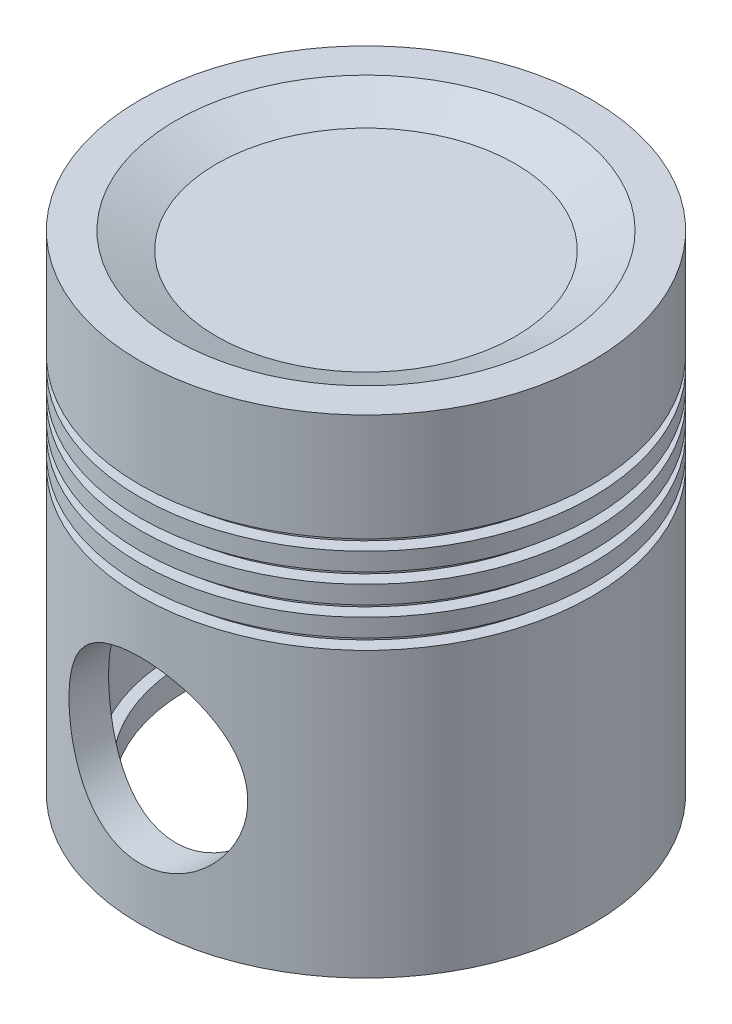
from build123d import *

# Parameters (mm, degrees)
CUT_EXTRUDE2_DEPTH      = 115.535519609
CUT_EXTRUDE2_DEPTH_BACK = 115.535519609
SKETCH2_R               = 25
SKETCH3_R               = 50
CUT_EXTRUDE4_DEPTH      = 11


with BuildPart() as part:
    # Sketch1 → Revolve1 (revolve)
    with BuildSketch(Plane.XY, mode=Mode.PRIVATE) as revolve1_sk:
        Polygon((-63.203744258, 71.61674857), (-63.203744258, 41.61674857), (-59.626173828, 41.61674857), (-59.626173828, 38.61674857), (-63.203744258, 38.61674857), (-63.203744258, 33.61674857), (-59.626173828, 33.61674857), (-59.626173828, 30.61674857), (-63.203744258, 30.61674857), (-63.203744258, 25.61674857), (-59.626173828, 25.61674857), (-59.626173828, 22.61674857), (-63.203744258, 22.61674857), (-63.203744258, 17.61674857), (-59.626173828, 17.61674857), (-59.626173828, 14.61674857), (-63.203744258, 14.61674857), (-63.203744258, -64.740949558), (0, -64.740949558), (0, -57.740949558), (-53.203744258, -57.740949558), (-53.203744258, 56.61674857), (0, 56.61674857), (0, 66.852401658), (-41.78964032, 66.852401658), (-53.203744258, 71.61674857), align=None)
    revolve(revolve1_sk.sketch.rotate(Axis((0, 112.693468535, 0), (0, -1, 0)), 270), axis=Axis((0, 112.693468535, 0), (0, -1, 0)))

    # Sketch2 → Cut-Extrude2 (cut, two sides: drawn at the far end of the back side and taken through both)
    with BuildSketch(Plane.XY.offset(-CUT_EXTRUDE2_DEPTH_BACK)):
        with Locations((0, -25.062100494)):
            Circle(SKETCH2_R)
    extrude(amount=CUT_EXTRUDE2_DEPTH + CUT_EXTRUDE2_DEPTH_BACK, mode=Mode.SUBTRACT)

    # Sketch3 → Cut-Extrude4 (cut)
    with BuildSketch(Plane.XZ.offset(64.740949558)):
        with Locations(Location((0, 0, 0), (0, 0, 270))):
            Circle(SKETCH3_R)
    extrude(amount=-CUT_EXTRUDE4_DEPTH, mode=Mode.SUBTRACT)


solid = part.part
